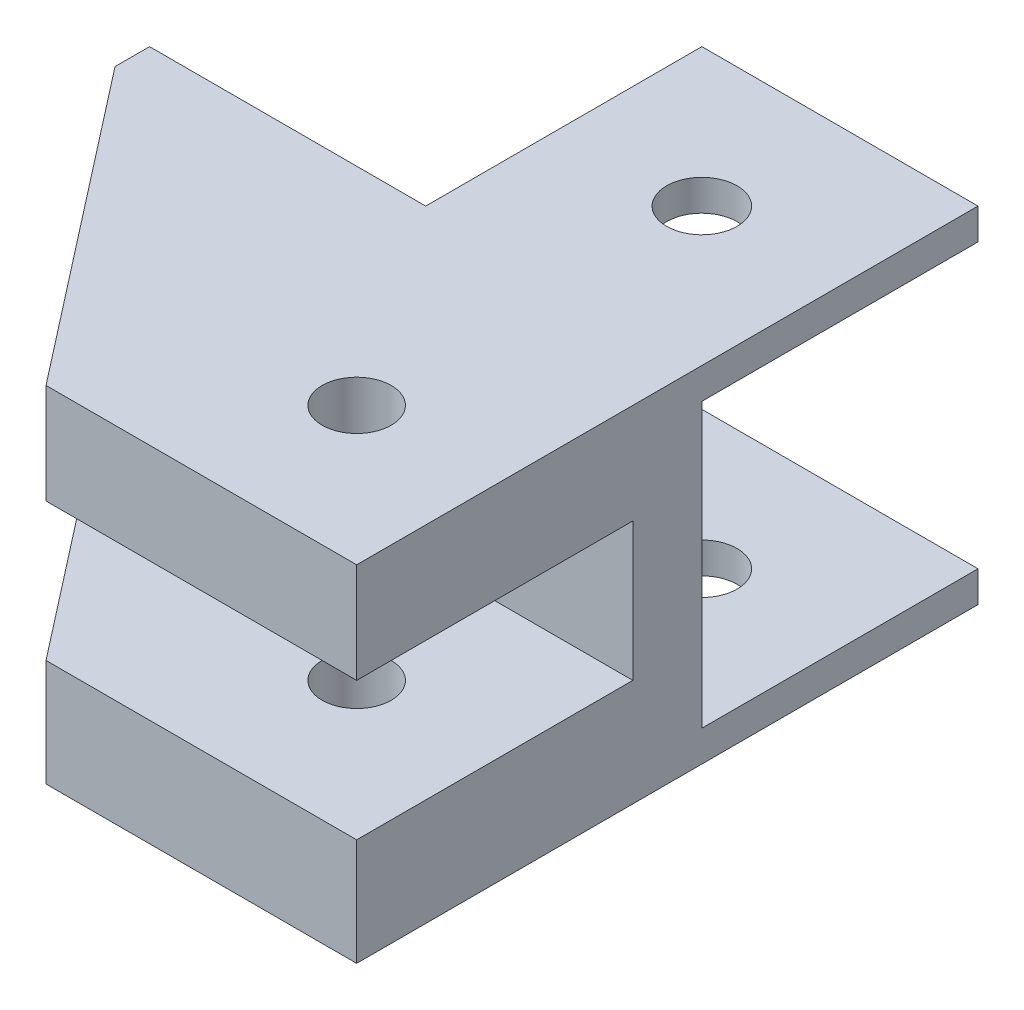
from build123d import *

# Parameters (mm, degrees)
SKETCH2_W           = 20
SKETCH2_H           = 5
SKETCH2_H_2         = 5.5
BOSS_EXTRUDE1_DEPTH = 20
SKETCH3_R           = 2.5
SKETCH3_R_2         = 2.55
CUT_EXTRUDE1_DEPTH  = 56.226805086
BOSS_EXTRUDE2_DEPTH = 20
CUT_EXTRUDE2_DEPTH  = 56.226805086
SKETCH7_R           = 2.55
CUT_EXTRUDE3_DEPTH  = 20


with BuildPart() as part:
    # Sketch2 → Boss-Extrude1 (new body)
    with BuildSketch(Plane(origin=(0, 0, 0), x_dir=(0, 0, -1), z_dir=(1, 0, 0))):
        Polygon((20, 7.75), (20, 2.25), (25, 2.25), (25, 22.75), (20, 22.75), (20, 17.75), align=None)
        Polygon((25, 22.75), (45, 22.75), (45, 25), (0, 25), (0, 22.75), (20, 22.75), align=None)
        Polygon((0, 2.25), (0, 0), (45, 0), (45, 2.25), (25, 2.25), (20, 2.25), align=None)
        with Locations((10, 20.25)):
            Rectangle(SKETCH2_W, SKETCH2_H)
        with Locations((10, 5)):
            Rectangle(SKETCH2_W, SKETCH2_H_2)
    extrude(amount=BOSS_EXTRUDE1_DEPTH)

    # Sketch3 → Cut-Extrude1 (cut, through all)
    with BuildSketch(Plane(origin=(0, 25, 0), x_dir=(1, 0, 0), z_dir=(0, 1, 0))):
        with Locations(Location((10, 10, 0), (0, 0, 270))):
            Circle(SKETCH3_R)
        with Locations(Location((10, 35, 0), (0, 0, 270))):
            Circle(SKETCH3_R_2)
    extrude(amount=-CUT_EXTRUDE1_DEPTH, mode=Mode.SUBTRACT)

    # Sketch5 → Boss-Extrude2 (add)
    with BuildSketch(Plane.ZY):
        Polygon((-25, 25), (-25, 22.75), (-25, 2.25), (-25, 0), (0, 0), (0, 7.75), (-20, 7.75), (-20, 17.75), (0, 17.75), (0, 25), align=None)
    extrude(amount=BOSS_EXTRUDE2_DEPTH)

    # Sketch6 → Cut-Extrude2 (cut, through all)
    with BuildSketch(Plane.XZ):
        Polygon((-20, -22.5), (-2.5, 0), (-20, 0), align=None)
    extrude(amount=-CUT_EXTRUDE2_DEPTH, mode=Mode.SUBTRACT)

    # Sketch7 → Cut-Extrude3 (cut)
    with BuildSketch(Plane.XY.offset(-20)):
        with Locations((-10, 12.5)):
            Circle(SKETCH7_R)
    extrude(amount=-CUT_EXTRUDE3_DEPTH, mode=Mode.SUBTRACT)


solid = part.part
